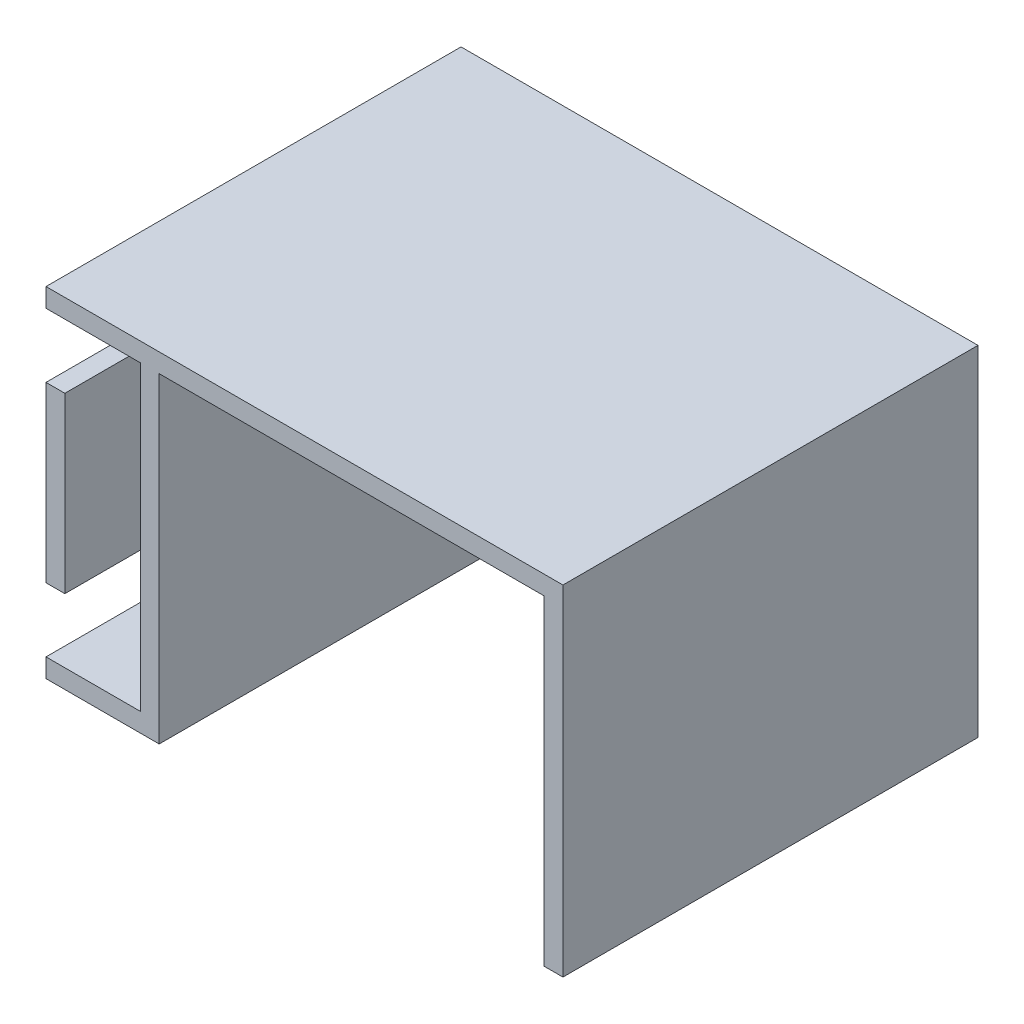
from build123d import *

# Parameters (mm, degrees)
BOSS_EXTRUDE2_DEPTH = 22
SKETCH3_W           = 4
SKETCH3_H           = 16
BOSS_EXTRUDE3_DEPTH = 1
SKETCH6_W           = 5
SKETCH6_H           = 1
BOSS_EXTRUDE4_DEPTH = 22
CUT_EXTRUDE1_REACH  = 38.851
SKETCH7_W           = 21
SKETCH7_H           = 3.4


with BuildPart() as part:
    # Sketch2 → Boss-Extrude2 (new body)
    with BuildSketch(Plane.XY):
        Polygon((11.2, -6.9), (11.2, 11.1), (-11.2, 11.1), (-11.2, -5.9), (-15.2, -5.9), (-15.2, 10.1), (-16.2, 10.1), (-16.2, -6.9), (-10.2, -6.9), (-10.2, 10.1), (10.2, 10.1), (10.2, -6.9), align=None)
    extrude(amount=BOSS_EXTRUDE2_DEPTH)

    # Sketch3 → Boss-Extrude3 (add)
    with BuildSketch(Plane(origin=(0, 0, 0), x_dir=(-1, 0, 0), z_dir=(0, 0, -1))):
        with Locations((13.2, 2.1)):
            Rectangle(SKETCH3_W, SKETCH3_H)
    extrude(amount=-BOSS_EXTRUDE3_DEPTH)

    # Sketch6 → Boss-Extrude4 (add)
    with BuildSketch(Plane.XY.offset(22)):
        with Locations((-13.7, 10.6)):
            Rectangle(SKETCH6_W, SKETCH6_H)
    extrude(amount=-BOSS_EXTRUDE4_DEPTH)

    # Sketch7 → Cut-Extrude1 (cut, up to next)
    with BuildSketch(Plane.ZY.offset(16.2), mode=Mode.PRIVATE) as cut_extrude1_sk1:
        with Locations((11.5, -4.2)):
            Rectangle(SKETCH7_W, SKETCH7_H)
    cut_extrude1_tool1 = extrude(cut_extrude1_sk1.sketch, amount=-CUT_EXTRUDE1_REACH, mode=Mode.PRIVATE) & part.part
    # Sketch7 → Cut-Extrude1 (cut, up to next)
    with BuildSketch(Plane.ZY.offset(16.2), mode=Mode.PRIVATE) as cut_extrude1_sk2:
        with Locations((11.5, 8.4)):
            Rectangle(SKETCH7_W, SKETCH7_H)
    cut_extrude1_tool2 = extrude(cut_extrude1_sk2.sketch, amount=-CUT_EXTRUDE1_REACH, mode=Mode.PRIVATE) & part.part
    add(cut_extrude1_tool1.solids().sort_by_distance((-16.2, -4.2, 11.5))[0], mode=Mode.SUBTRACT)
    add(cut_extrude1_tool2.solids().sort_by_distance((-16.2, 8.4, 11.5))[0], mode=Mode.SUBTRACT)


solid = part.part
